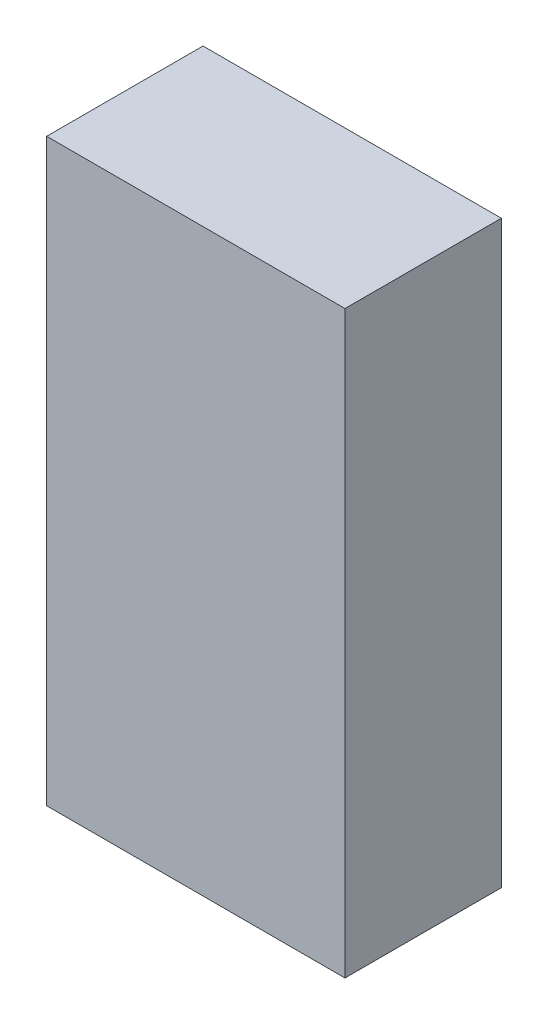
from build123d import *

# Parameters (mm, degrees)
SKETCH1_W           = 124
SKETCH1_H           = 241
BOSS_EXTRUDE1_DEPTH = 65


with BuildPart() as part:
    # Sketch1 → Boss-Extrude1 (new body)
    with BuildSketch(Plane.XY):
        Rectangle(SKETCH1_W, SKETCH1_H)
    extrude(amount=BOSS_EXTRUDE1_DEPTH)


solid = part.part
